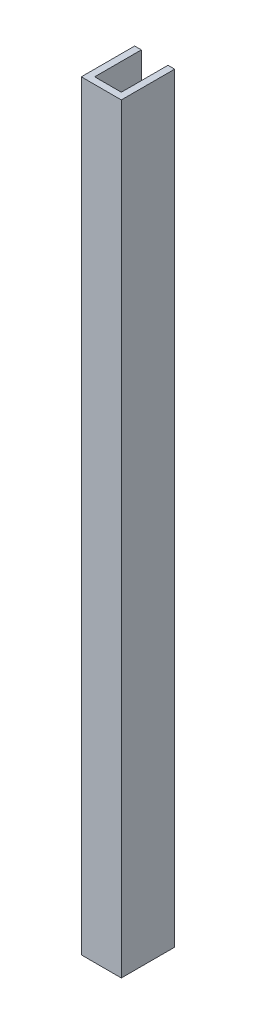
from build123d import *

# Parameters (mm, degrees)
EXTRUDE_THIN1_DEPTH = 361.95


with BuildPart() as part:
    # Sketch1 → Extrude-Thin1 (new body)
    with BuildSketch(Plane(origin=(0, 0, 0), x_dir=(1, 0, 0), z_dir=(0, 1, 0))):
        Polygon((0, 25.4), (0, 0), (19.05, 0), (19.05, 25.4), (15.875, 25.4), (15.875, 3.175), (3.175, 3.175), (3.175, 25.4), align=None)
    extrude(amount=EXTRUDE_THIN1_DEPTH)


solid = part.part
